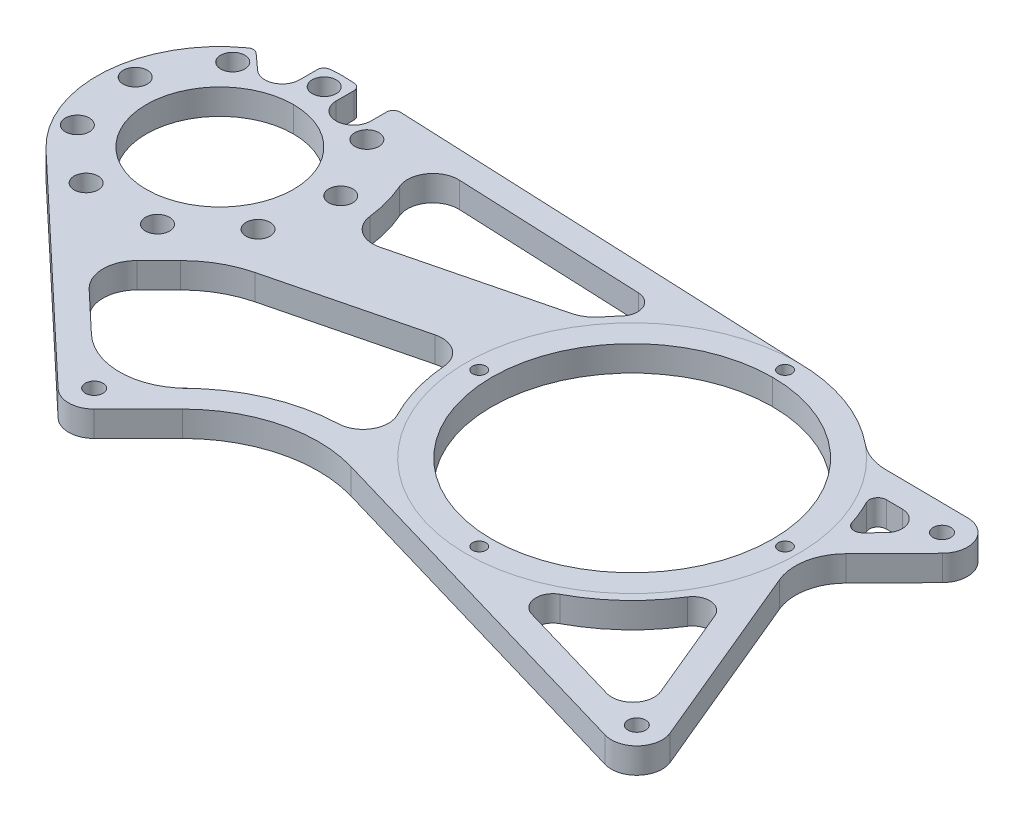
from build123d import *

# Parameters (mm, degrees)
MASTER_SKETCH_R       = 52.451
MASTER_SKETCH_R_2     = 9.525
MASTER_SKETCH_R_3     = 27.4955
MASTER_SKETCH_R_4     = 6.5
BOSS_EXTRUDE2_DEPTH   = 4.7625
F_5_0MM_DOWEL_HOLE1_D = 5
CIRPATTERN4_COUNT     = 4
M6_CLEARANCE_HOLE4_D  = 6.6
M8_CLEARANCE_HOLE1_D  = 9
CIRPATTERN3_COUNT     = 9
CUT_EXTRUDE2_DEPTH    = 281.006585399
CUT_EXTRUDE3_DEPTH    = 281.006585399
FILLET1_R             = 2.54


with BuildPart() as part:
    # Master Sketch → Boss-Extrude2 (new, symmetric)
    # profile 1 of 5: a face of its own
    with BuildSketch(Plane(origin=(0, 0, 0), x_dir=(1, 0, 0), z_dir=(0, 1, 0))):
        with BuildLine():
            ThreePointArc((-8.636, 127), (-36.396097826, 84.787887478), (-86.152093601, 93.552952189))
            Line((-86.152093601, 93.552952189), (-6.534964144, 18.470363023))
            ThreePointArc((-6.534964144, 18.470363023), (-3.773598517, 34.145603423), (9.525, 25.4))
            ThreePointArc((9.525, 25.4), (8.799952547, 21.754940307), (6.735192091, 18.664807909))
            Line((6.735192091, 18.664807909), (23.243231805, 35.172847623))
            ThreePointArc((23.243231805, 35.172847623), (46.587798651, 48.47044475), (73.449951392, 48.001786374))
            Line((73.449951392, 48.001786374), (207.780426054, 8.637567885))
            ThreePointArc((207.780426054, 8.637567885), (203.365353978, 24.134749361), (219.252182081, 21.439533608))
            Line((219.252182081, 21.439533608), (190.024652545, 91.633132973))
            ThreePointArc((190.024652545, 91.633132973), (188.9083984, 102.577169262), (194.028954622, 112.313588397))
            Line((194.028954622, 112.313588397), (211.918529766, 130.503579499))
            ThreePointArc((211.918529766, 130.503579499), (196.325302338, 133.542806943), (205.218502749, 146.70702479))
            Line((205.218502749, 146.70702479), (174.268477279, 147.002761769))
            ThreePointArc((174.268477279, 147.002761769), (167.967389572, 148.13899706), (162.39865644, 151.298735696))
            ThreePointArc((162.39865644, 151.298735696), (144.003054669, 161.678519087), (123.19, 165.2778))
            Line((123.19, 165.2778), (-50.637408401, 172.802043535))
            ThreePointArc((-50.637408401, 172.802043535), (-20.726046555, 158.072276629), (-8.636, 127))
        make_face()
        with Locations(Location((123.19, 103.3018, 0), (0, 0, 90))):
            Circle(MASTER_SKETCH_R, mode=Mode.SUBTRACT)
    # profile 2 of 5: a face of its own
    with BuildSketch(Plane(origin=(0, 0, 0), x_dir=(1, 0, 0), z_dir=(0, 1, 0))):
        with Locations((210.458993886, 17.778185992)):
            Circle(MASTER_SKETCH_R_2)
    # profile 3 of 5: a face of its own
    with BuildSketch(Plane(origin=(0, 0, 0), x_dir=(1, 0, 0), z_dir=(0, 1, 0))):
        with Locations((0, 25.4)):
            Circle(MASTER_SKETCH_R_2)
    # profile 4 of 5: a face of its own
    with BuildSketch(Plane(origin=(0, 0, 0), x_dir=(1, 0, 0), z_dir=(0, 1, 0))):
        with Locations((205.12749261, 137.182459595)):
            Circle(MASTER_SKETCH_R_2)
    # profile 5 of 5: a face of its own
    with BuildSketch(Plane(origin=(0, 0, 0), x_dir=(1, 0, 0), z_dir=(0, 1, 0))):
        with BuildLine():
            ThreePointArc((-54.61, 172.974), (-97.337644752, 143.969297274), (-86.152093601, 93.552952189))
            ThreePointArc((-86.152093601, 93.552952189), (-36.396097826, 84.787887478), (-8.636, 127))
            ThreePointArc((-8.636, 127), (-20.726046555, 158.072276629), (-50.637408401, 172.802043535))
            Line((-50.637408401, 172.802043535), (-54.61, 172.974))
        make_face()
        with Locations(Location((-54.61, 127, 0), (0, 0, 90))):
            Circle(MASTER_SKETCH_R_3, mode=Mode.SUBTRACT)
        with Locations(Location((-67.94878559, 163.648012211, 0), (0, 0, 90))):
            Circle(MASTER_SKETCH_R_4, mode=Mode.SUBTRACT)
        with Locations(Location((-41.27121441, 163.648012211, 0), (0, 0, 90))):
            Circle(MASTER_SKETCH_R_4, mode=Mode.SUBTRACT)
    extrude(amount=BOSS_EXTRUDE2_DEPTH, both=True)

    # Ø5.0mm Dowel Hole1 (through all)
    with Locations(Plane(origin=(0, 4.7625, 0), x_dir=(1, 0, 0), z_dir=(0, 1, 0))):
        with Locations((123.19, 160.4518)):
            f_5_0mm_dowel_hole1 = Hole(F_5_0MM_DOWEL_HOLE1_D / 2)

    # CirPattern4: Ø5.0mm Dowel Hole1 ×4 about axis
    cirpattern4_axis = Axis((123.19, 0, -103.3018), (0, 1, 0))
    for i in range(1, CIRPATTERN4_COUNT):
        add(f_5_0mm_dowel_hole1.rotate(cirpattern4_axis, i * 360 / CIRPATTERN4_COUNT), mode=Mode.SUBTRACT)

    # M6 Clearance Hole4 (through all)
    with Locations(Plane(origin=(0, 4.7625, 0), x_dir=(1, 0, 0), z_dir=(0, 1, 0))):
        with Locations((205.12749261, 137.182459595), (210.458993886, 17.778185992), (0, 25.4)):
            Hole(M6_CLEARANCE_HOLE4_D / 2)

    # M8 Clearance Hole1 (through all)
    with Locations(Plane(origin=(0, 4.7625, 0), x_dir=(1, 0, 0), z_dir=(0, 1, 0))):
        with Locations((-54.61, 166)):
            m8_clearance_hole1 = Hole(M8_CLEARANCE_HOLE1_D / 2)

    # CirPattern3: M8 Clearance Hole1 ×9 about axis
    cirpattern3_axis = Axis((-54.61, 0, -127), (0, 1, 0))
    for i in range(1, CIRPATTERN3_COUNT):
        add(m8_clearance_hole1.rotate(cirpattern3_axis, i * 360 / CIRPATTERN3_COUNT), mode=Mode.SUBTRACT)

    # Topology 3 → Cut-Extrude2 (cut, through all)
    with BuildSketch(Plane(origin=(0, 4.7625, 0), x_dir=(1, 0, 0), z_dir=(0, 1, 0))):
        with BuildLine():
            ThreePointArc((17.44176984, 42.84176984), (-0.146601343, 35.405008389), (-17.945313453, 42.323250142))
            Line((-17.945313453, 42.323250142), (-33.032755262, 56.551396808))
            ThreePointArc((-33.032755262, 56.551396808), (-37.018106584, 65.604842248), (-33.299725858, 74.771168898))
            Line((-33.299725858, 74.771168898), (-25.157987823, 82.912906934))
            ThreePointArc((-25.157987823, 82.912906934), (-16.98904431, 89.126755018), (-7.457826773, 92.934567826))
            Line((-7.457826773, 92.934567826), (46.455825782, 106.412980965))
            ThreePointArc((46.455825782, 106.412980965), (54.31445648, 104.914466858), (58.258837609, 97.954188236))
            ThreePointArc((58.258837609, 97.954188236), (60.562629767, 85.344481192), (65.290751922, 73.429908983))
            ThreePointArc((65.290751922, 73.429908983), (65.041767103, 64.243340795), (57.144809578, 59.543012047))
            ThreePointArc((57.144809578, 59.543012047), (35.149119712, 54.590587492), (16.508039714, 41.908039714))
            Line((16.508039714, 41.908039714), (17.44176984, 42.84176984))
        make_face()
        with BuildLine():
            ThreePointArc((70.803785714, 158.011455607), (76.396746832, 154.095181656), (75.205983312, 147.372050096))
            ThreePointArc((75.205983312, 147.372050096), (73.43400978, 145.361213194), (71.746239826, 143.279197866))
            ThreePointArc((71.746239826, 143.279197866), (68.65233257, 140.432136587), (64.798418838, 138.751253195))
            Line((64.798418838, 138.751253195), (7.651359628, 124.464488392))
            ThreePointArc((7.651359628, 124.464488392), (-0.093621954, 125.882803807), (-4.12477238, 132.646396384))
            ThreePointArc((-4.12477238, 132.646396384), (-5.583091379, 140.304218545), (-8.195896476, 147.648752845))
            ThreePointArc((-8.195896476, 147.648752845), (-7.366745421, 156.880779005), (0.918658655, 161.03648325))
            Line((0.918658655, 161.03648325), (70.803785714, 158.011455607))
        make_face()
        with BuildLine():
            ThreePointArc((153.7341925, 45.75438385), (167.575229688, 55.608989362), (178.397536188, 68.70728094))
            ThreePointArc((178.397536188, 68.70728094), (184.302356988, 71.663840908), (189.640513132, 67.776393867))
            Line((189.640513132, 67.776393867), (204.070964881, 33.119843524))
            ThreePointArc((204.070964881, 33.119843524), (202.654674642, 24.77158437), (194.511168192, 22.451538756))
            Line((194.511168192, 22.451538756), (154.925497425, 34.05172849))
            ThreePointArc((154.925497425, 34.05172849), (150.393857669, 39.502381203), (153.7341925, 45.75438385))
        make_face()
        with BuildLine():
            Line((190.422266455, 122.2302916), (194.644093936, 126.523015363))
            ThreePointArc((194.644093936, 126.523015363), (195.984862679, 133.402037195), (190.177409258, 137.325312223))
            Line((190.177409258, 137.325312223), (184.156778477, 137.382841196))
            ThreePointArc((184.156778477, 137.382841196), (181.428820013, 135.882340302), (181.294822723, 132.771825065))
            ThreePointArc((181.294822723, 132.771825065), (183.396981456, 128.197024139), (185.139600999, 123.473555924))
            ThreePointArc((185.139600999, 123.473555924), (187.431229964, 121.366022532), (190.422266455, 122.2302916))
        make_face()
    extrude(amount=-CUT_EXTRUDE2_DEPTH, mode=Mode.SUBTRACT)

    # Sketch29 → Cut-Extrude3 (cut, through all)
    with BuildSketch(Plane.XZ.offset(4.7625)):
        with BuildLine():
            Line((-72.305646266, -158.824345033), (-79.713448931, -165.515263569))
            ThreePointArc((-79.713448931, -165.515263569), (-70.954498766, -169.970525201), (-61.44878559, -172.462508594))
            Line((-61.44878559, -172.462508594), (-61.44878559, -163.648012211))
            ThreePointArc((-61.44878559, -163.648012211), (-70.587952655, -169.588112984), (-72.305646266, -158.824345033))
        make_face()
        with BuildLine():
            Line((-47.77121441, -163.648012211), (-47.77121441, -172.677978281))
            Line((-47.77121441, -172.677978281), (-34.77121441, -172.115263995))
            Line((-34.77121441, -172.115263995), (-34.77121441, -163.648012211))
            ThreePointArc((-34.77121441, -163.648012211), (-41.27121441, -170.148012211), (-47.77121441, -163.648012211))
        make_face()
    extrude(amount=-CUT_EXTRUDE3_DEPTH, mode=Mode.SUBTRACT)

    # Fillet1
    fillet1_edges = [part.edges().sort_by_distance(p)[0] for p in [
        (-61.44878559, 0, -172.462508594),
        (-79.713448931, 0, -165.515263569),
        (-34.77121441, 0, -172.115263995),
        (-47.77121441, 0, -172.677978281),
    ]]
    fillet(fillet1_edges, radius=FILLET1_R)


solid = part.part
